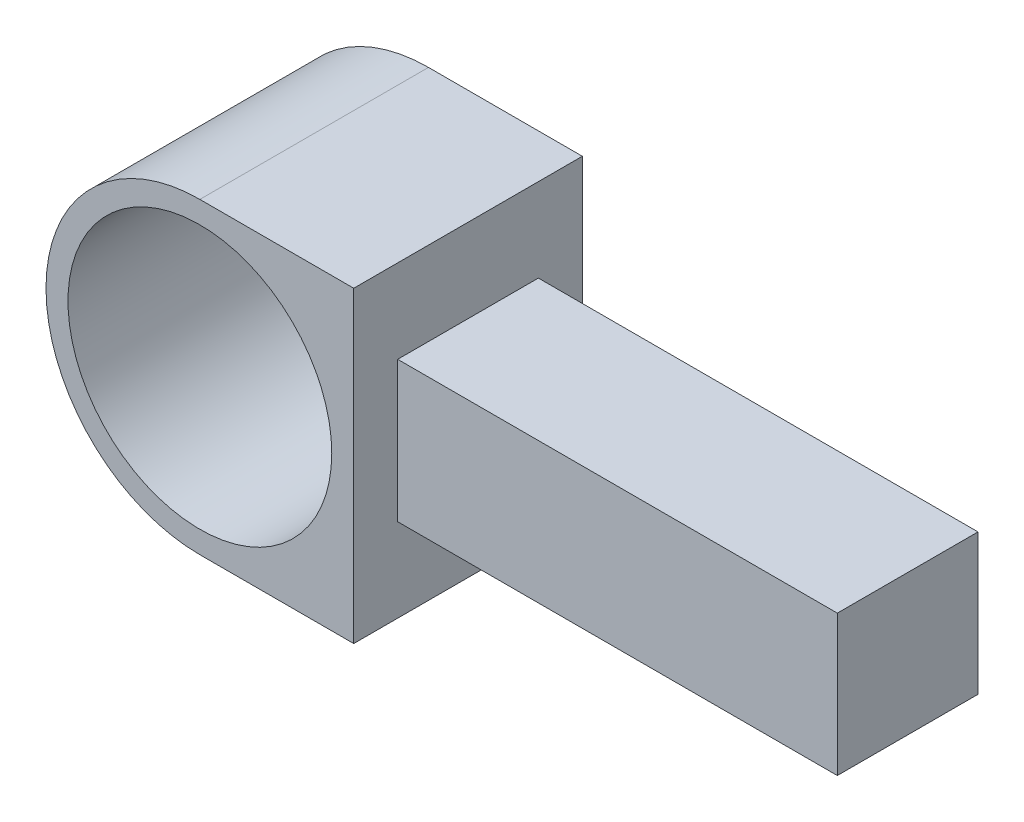
from build123d import *

# Parameters (mm, degrees)
EXTRUDE_1_DEPTH     = 26
SKETCH_2_R          = 15
CUT_EXTRUDE_1_DEPTH = 26
SKETCH_3_W          = 16
SKETCH_3_H          = 16
EXTRUDE_2_DEPTH     = 50


with BuildPart() as part:
    # 草图1 → 凸台-拉伸1 (new body)
    with BuildSketch(Plane.XY):
        with BuildLine():
            Line((0, 17.5), (17.5, 17.5))
            Line((17.5, 17.5), (17.5, -17.5))
            Line((17.5, -17.5), (0, -17.5))
            ThreePointArc((0, -17.5), (-17.5, 0), (0, 17.5))
        make_face()
    extrude(amount=EXTRUDE_1_DEPTH)

    # 草图2 → 切除-拉伸1 (cut)
    with BuildSketch(Plane.XY.offset(26)):
        Circle(SKETCH_2_R)
    extrude(amount=-CUT_EXTRUDE_1_DEPTH, mode=Mode.SUBTRACT)

    # 草图3 → 凸台-拉伸2 (add)
    with BuildSketch(Plane(origin=(17.5, 0, 0), x_dir=(0, 0, -1), z_dir=(1, 0, 0))):
        with Locations((-13, 0)):
            Rectangle(SKETCH_3_W, SKETCH_3_H)
    extrude(amount=EXTRUDE_2_DEPTH)


solid = part.part
